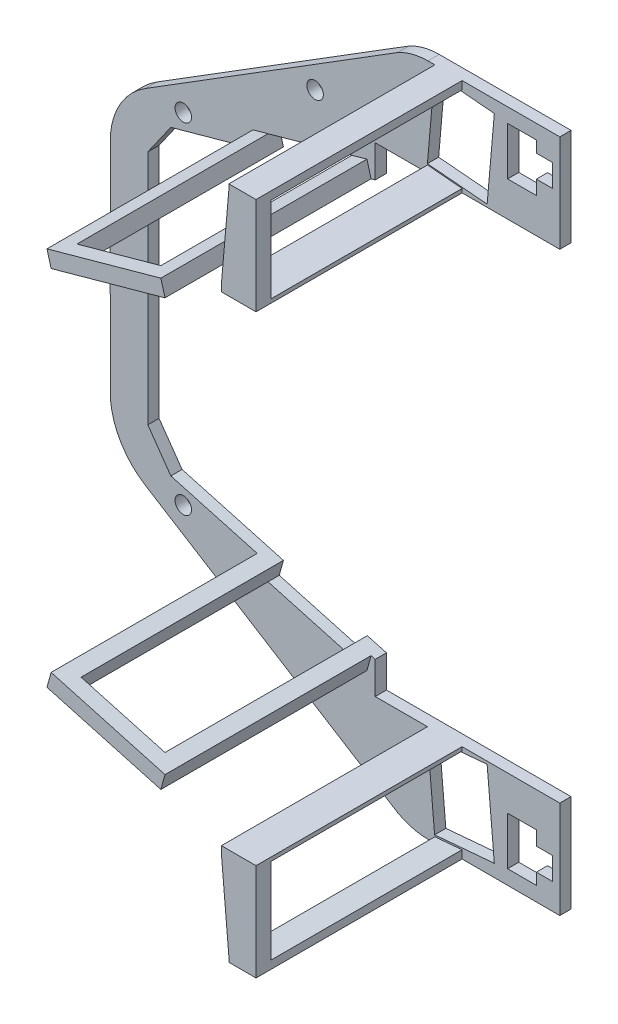
from build123d import *

# Parameters (mm, degrees)
SKETCH1_R           = 1.1
BOSS_EXTRUDE1_DEPTH = 1.5
BOSS_EXTRUDE2_DEPTH = 25.5
BOSS_EXTRUDE4_DEPTH = 2


with BuildPart() as part:
    # Sketch1 → Boss-Extrude1 (new body)
    with BuildSketch(Plane.XY):
        with BuildLine():
            Line((65, 15), (65, 5))
            Line((65, 5), (47.403, 5.0215))
            ThreePointArc((47.403, 5.0215), (45.32489976, 5.287606245), (43.379, 6.064))
            Line((43.379, 6.064), (9.7, 27.063))
            ThreePointArc((9.7, 27.063), (6.483564725, 30.296790106), (5.042, 34.624))
            Line((5.042, 34.624), (5, 50))
            Line((5, 50), (5.042, 65.376))
            ThreePointArc((5.042, 65.376), (6.483564725, 69.703209894), (9.7, 72.937))
            Line((9.7, 72.937), (43.379, 93.936))
            ThreePointArc((43.379, 93.936), (45.32489976, 94.712393755), (47.403, 94.9785))
            Line((47.403, 94.9785), (65, 95))
            Line((65, 95), (65, 85))
            Line((65, 85), (65, 82))
            Line((65, 82), (40.367460006, 82))
            Line((40.367460006, 82), (40.367460006, 77.700799702))
            Line((40.367460006, 77.700799702), (37.816539887, 76.993905452))
            Line((37.816539887, 76.993905452), (37.261948992, 78.995219046))
            Line((37.261948992, 78.995219046), (26.063497318, 75.891977576))
            Line((26.063497318, 75.891977576), (26.618088213, 73.890663982))
            Line((26.618088213, 73.890663982), (13.092809655, 70.14262751))
            Line((13.092809655, 70.14262751), (10.021, 65.77301003))
            Line((10.021, 65.77301003), (10.021, 34.22698997))
            Line((10.021, 34.22698997), (13.092809655, 29.85737249))
            Line((13.092809655, 29.85737249), (26.618088213, 26.109336018))
            Line((26.618088213, 26.109336018), (26.063497318, 24.108022424))
            Line((26.063497318, 24.108022424), (37.261948992, 21.004780954))
            Line((37.261948992, 21.004780954), (37.816539887, 23.006094548))
            Line((37.816539887, 23.006094548), (40.367460006, 22.299200298))
            Line((40.367460006, 22.299200298), (40.367460006, 18))
            Line((40.367460006, 18), (65, 18))
            Line((65, 18), (65, 15))
        make_face()
        with Locations((32.343, 84.089)):
            Circle(SKETCH1_R, mode=Mode.SUBTRACT)
        with Locations((14.76, 72.68)):
            Circle(SKETCH1_R, mode=Mode.SUBTRACT)
        with Locations((14.76, 27.32)):
            Circle(SKETCH1_R, mode=Mode.SUBTRACT)
        with Locations((32.343, 15.911)):
            Circle(SKETCH1_R, mode=Mode.SUBTRACT)
        Polygon((47.33363322, 83.065556795), (55.303190804, 82.368310853), (56.261903975, 93.326452532), (48.29234639, 94.023698474), align=None, mode=Mode.SUBTRACT)
        Polygon((58.032899046, 86.65175686), (61.864724228, 86.65175686), (61.864724228, 88.544627634), (64.004574654, 88.544627634), (64.004574654, 91.546423221), (61.864868117, 91.546423221), (61.864868117, 93.072013731), (58.032899046, 93.072013731), align=None, mode=Mode.SUBTRACT)
        Polygon((56.261903975, 6.673547468), (48.29234639, 5.976301526), (47.33363322, 16.934443205), (55.303190804, 17.631689147), align=None, mode=Mode.SUBTRACT)
        Polygon((58.032899046, 13.34824314), (61.864724228, 13.34824314), (61.864724228, 11.455372366), (64.004574654, 11.455372366), (64.004574654, 8.453576779), (61.864868117, 8.453576779), (61.864868117, 6.927986269), (58.032899046, 6.927986269), align=None, mode=Mode.SUBTRACT)
    extrude(amount=BOSS_EXTRUDE1_DEPTH)

    # Sketch2 → Boss-Extrude2 (add)
    with BuildSketch(Plane.XY.offset(1.5)):
        Polygon((26.618088213, 26.109336018), (26.063497318, 24.108022424), (24.063497318, 24.662249304), (24.618088213, 26.663562898), align=None)
        Polygon((37.261948992, 21.004780954), (37.816539887, 23.006094548), (39.816539887, 22.451867667), (39.261948992, 20.450554074), align=None)
        Polygon((39.816539887, 77.548132333), (39.261948992, 79.549445926), (37.261948992, 78.995219046), (37.816539887, 76.993905452), align=None)
        Polygon((26.063497318, 75.891977576), (24.063497318, 75.337750696), (24.618088213, 73.336437102), (26.618088213, 73.890663982), align=None)
        Polygon((47.340340229, 18), (51.96241715, 18), (51.96241715, 17.488205474), (47.340340229, 17.083826141), align=None)
        Polygon((48.330167759, 5.770045696), (51.96241715, 6.087826341), (51.96241715, 5.015929308), (48.330167759, 5.020367187), (48.330167759, 5.551877825), align=None)
        Polygon((48.330167759, 94.979632813), (48.330167759, 94.448122175), (48.330167759, 94.229954304), (51.96241715, 93.912173659), (51.96241715, 94.984070692), align=None)
        Polygon((47.340340229, 82.916173859), (51.96241715, 82.511794526), (51.96241715, 82), (47.340340229, 82), align=None)
    extrude(amount=BOSS_EXTRUDE2_DEPTH)

    # Sketch4 → Boss-Extrude4 (add)
    with BuildSketch(Plane.XY.offset(27)):
        Polygon((48.330167759, 5.020367187), (48.330167759, 5.770045696), (47.340340229, 17.083826141), (47.340340229, 18), (51.96241715, 18), (51.96241715, 17.488205474), (51.96241715, 5.015929308), align=None)
        Polygon((24.618088213, 26.663562898), (39.816539887, 22.451867667), (39.261948992, 20.450554074), (24.063497318, 24.662249304), align=None)
        Polygon((51.96241715, 82.511794526), (51.96241715, 94.984070692), (48.330167759, 94.979632813), (48.330167759, 94.229954304), (47.340340229, 82.916173859), (47.340340229, 82), (51.96241715, 82), align=None)
        Polygon((39.261948992, 79.549445926), (24.063497318, 75.337750696), (24.618088213, 73.336437102), (39.816539887, 77.548132333), align=None)
    extrude(amount=BOSS_EXTRUDE4_DEPTH)


solid = part.part
